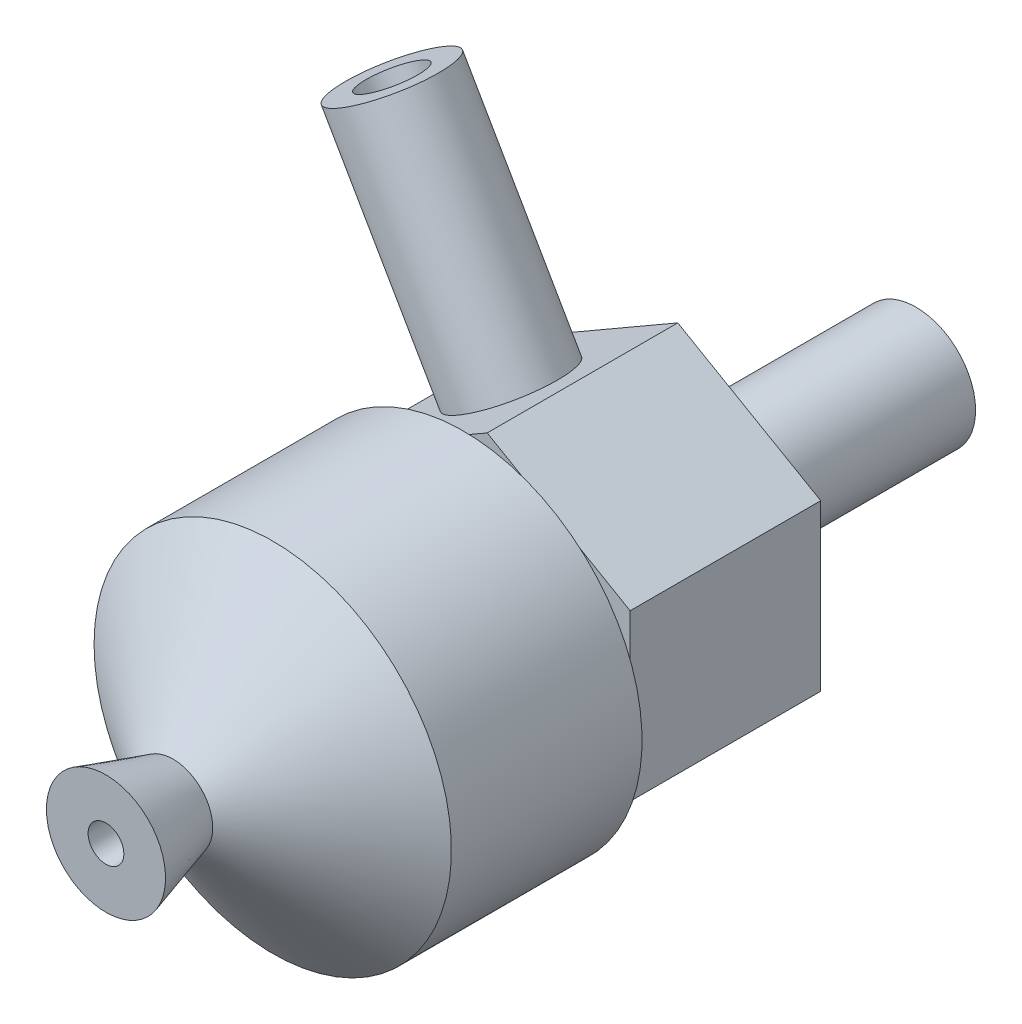
from build123d import *

# Parameters (mm, degrees)
SKETCH_1_R          = 2.5
EXTRUDE_1_DEPTH     = 10
EXTRUDE_2_DEPTH     = 8
SKETCH_3_R          = 2
EXTRUDE_3_DEPTH     = 1
SKETCH_5_R          = 0.75
CUT_EXTRUDE_1_DEPTH = 15
SKETCH_6_R          = 2.25
EXTRUDE_4_DEPTH     = 10
SKETCH_7_R          = 1.25
CUT_EXTRUDE_2_DEPTH = 22


with BuildPart() as part:
    # 草图1 → 凸台-拉伸1 (new body)
    with BuildSketch(Plane.XY):
        Circle(SKETCH_1_R)
    extrude(amount=EXTRUDE_1_DEPTH)

    # 草图2 → 凸台-拉伸2 (add)
    with BuildSketch(Plane.XY.offset(10)):
        Polygon((6, 3.464101615), (0, 6.92820323), (-6, 3.464101615), (-6, -3.464101615), (0, -6.92820323), (6, -3.464101615), align=None)
    extrude(amount=EXTRUDE_2_DEPTH)

    # 草图3 → 凸台-拉伸3 (add)
    with BuildSketch(Plane.XY.offset(18)):
        Circle(SKETCH_3_R)
    extrude(amount=EXTRUDE_3_DEPTH)

    # 草图4 → 旋转1 (revolve)
    with BuildSketch(Plane(origin=(0, 0, 0), x_dir=(1, 0, 0), z_dir=(0, 1, 0)), mode=Mode.PRIVATE) as revolve_1_sk:
        Polygon((0, -19), (7.5, -19), (7.5, -27), (1.664204883, -31.183358747), (2.5, -34), (0, -34), align=None)
    revolve(revolve_1_sk.sketch.rotate(Axis((0, 0, 19), (0, 0, 1)), 180), axis=Axis((0, 0, 19), (0, 0, 1)))

    # 草图5 → 切除-拉伸1 (cut)
    with BuildSketch(Plane.XY.offset(34)):
        Circle(SKETCH_5_R)
    extrude(amount=-CUT_EXTRUDE_1_DEPTH, mode=Mode.SUBTRACT)

    # 草图6 → 凸台-拉伸4 (add)
    with BuildSketch(Plane(origin=(-3, 5.196152423, 0), x_dir=(0.8660254037844388, 0.49999999999999983, 0), z_dir=(-0.4999999999999998, 0.8660254037844387, 0))):
        with Locations((0, -14)):
            Circle(SKETCH_6_R)
    extrude(amount=EXTRUDE_4_DEPTH)

    # 草图7 → 切除-拉伸2 (cut)
    with BuildSketch(Plane(origin=(-8, 13.856406461, 0), x_dir=(0.8660254037844387, 0.49999999999999994, 0), z_dir=(-0.4999999999999999, 0.8660254037844386, 0))):
        with Locations(Location((0, -14, 0), (0, 0, 180))):
            Circle(SKETCH_7_R)
    extrude(amount=-CUT_EXTRUDE_2_DEPTH, mode=Mode.SUBTRACT)


solid = part.part
